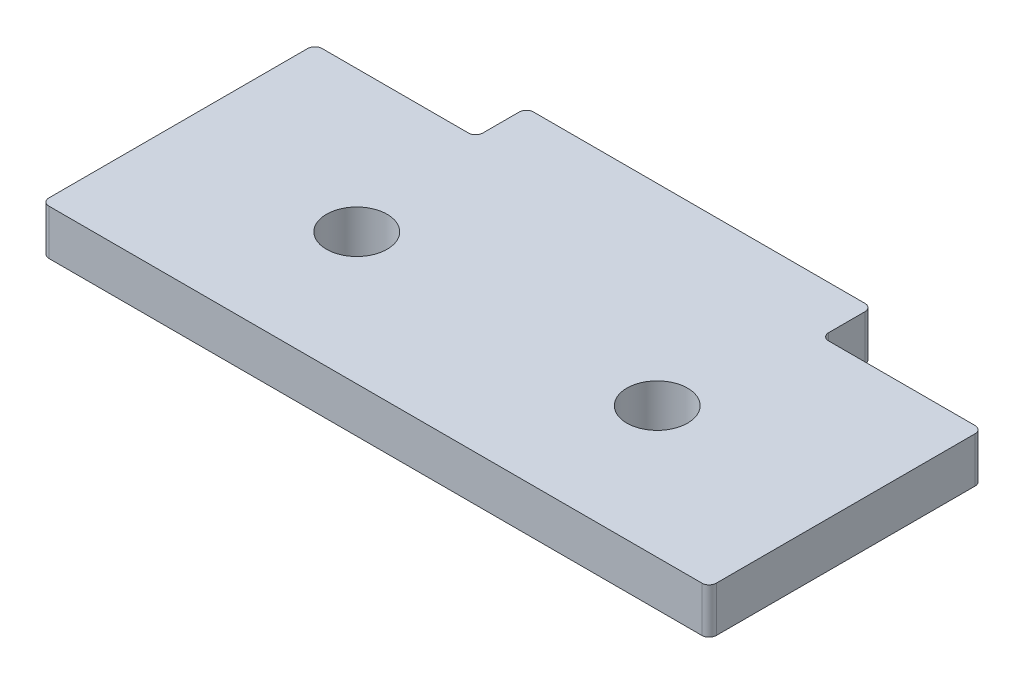
from build123d import *

# Parameters (mm, degrees)
BOSS_EXTRUDE2_DEPTH = 6.35
SKETCH3_R           = 4.25
CUT_EXTRUDE1_DEPTH  = 53.294538816
FILLET1_R           = 1


with BuildPart() as part:
    # Sketch2 → Boss-Extrude2 (new body)
    with BuildSketch(Plane(origin=(0, 0, 0), x_dir=(1, 0, 0), z_dir=(0, 1, 0))):
        Polygon((46.7, -22.660677173), (46.7, 15.560677173), (24.2, 15.560677173), (24.2, 22.660677173), (-24.2, 22.660677173), (-24.2, 15.560677173), (-46.7, 15.560677173), (-46.7, -22.660677173), align=None)
    extrude(amount=BOSS_EXTRUDE2_DEPTH)

    # Sketch3 → Cut-Extrude1 (cut, through all)
    with BuildSketch(Plane(origin=(0, 6.35, 0), x_dir=(1, 0, 0), z_dir=(0, 1, 0))):
        with Locations(Location((-21.05, -4.225241458, 0), (0, 0, 270))):
            Circle(SKETCH3_R)
        with Locations(Location((21.05, -4.275241458, 0), (0, 0, 270))):
            Circle(SKETCH3_R)
    extrude(amount=-CUT_EXTRUDE1_DEPTH, mode=Mode.SUBTRACT)

    # Fillet1
    fillet1_edges = [part.edges().sort_by_distance(p)[0] for p in [
        (-46.7, 3.175, 22.660677173),
        (-46.7, 3.175, -15.560677173),
        (-24.2, 3.175, -15.560677173),
        (-24.2, 3.175, -22.660677173),
        (24.2, 3.175, -22.660677173),
        (24.2, 3.175, -15.560677173),
        (46.7, 3.175, -15.560677173),
        (46.7, 3.175, 22.660677173),
    ]]
    fillet(fillet1_edges, radius=FILLET1_R)


solid = part.part
